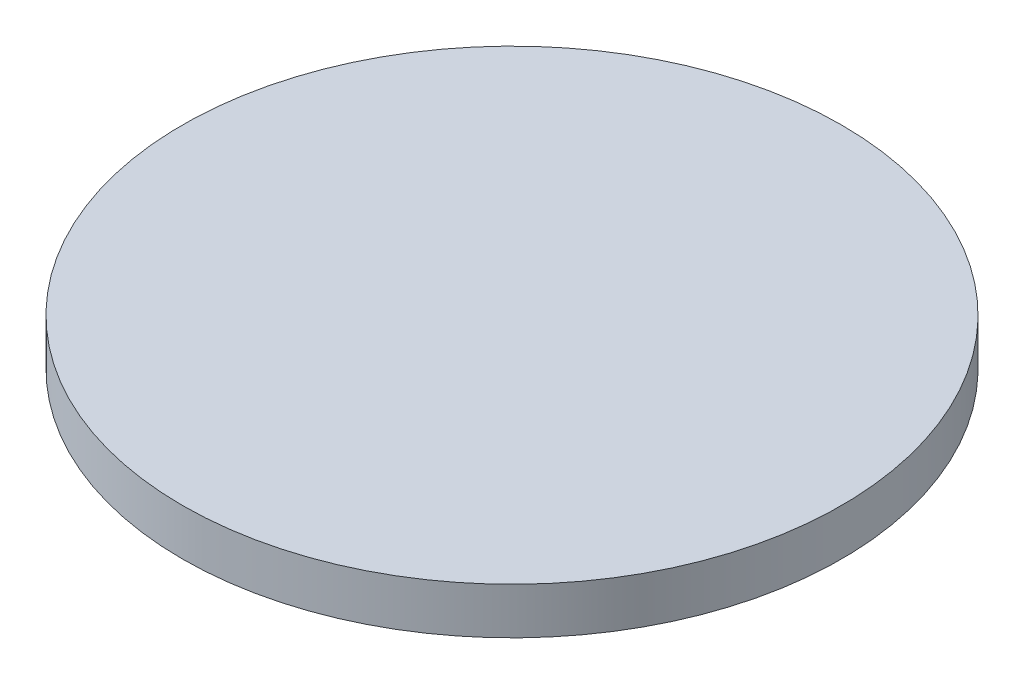
from build123d import *

# Parameters (mm, degrees)
PCB_SK1_R = 7.1
PCB_DEPTH = 1
MIC_SK2_W = 4.72
MIC_SK2_H = 3.76
MIC_DEPTH = 1.1


with BuildPart() as part:
    # PCB_Sk1 → PCB (new body)
    with BuildSketch(Plane(origin=(0, 28.4, 0), x_dir=(1, 0, 0), z_dir=(0, 1, 0))):
        with Locations(Location((16, 22.5, 0), (0, 0, 270))):
            Circle(PCB_SK1_R)
    extrude(amount=-PCB_DEPTH)

    # Mic_Sk2 → Mic (add)
    with BuildSketch(Plane(origin=(0, 27.4, 0), x_dir=(1, 0, 0), z_dir=(0, 1, 0))):
        with Locations((16, 22.5)):
            Rectangle(MIC_SK2_W, MIC_SK2_H)
    extrude(amount=-MIC_DEPTH)


solid = part.part
